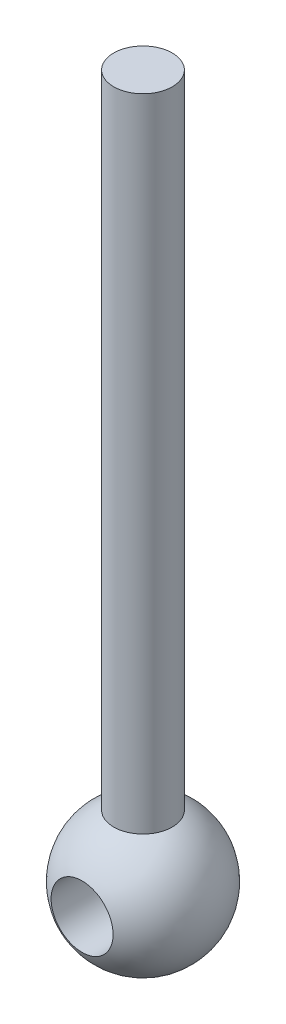
from build123d import *

# Parameters (mm, degrees)
REVOLVE1_ANGLE      = 359.999695921
BOSS_EXTRUDE1_START = 3.5
SKETCH2_R           = 3
BOSS_EXTRUDE1_DEPTH = 68.5


with BuildPart() as part:
    # Sketch1 → Revolve1 (revolve)
    with BuildSketch(Plane(origin=(0, 0, 0), x_dir=(1, 0, 0), z_dir=(0, 1, 0))):
        with BuildLine():
            Line((3.175, 6.238539493), (3.175, -6.238539493))
            ThreePointArc((3.175, -6.238539493), (7, 0), (3.175, 6.238539493))
        make_face()
    revolve(axis=Axis((0, 0, 6.238539493), (0, 0, -1)), revolution_arc=REVOLVE1_ANGLE)

    # Sketch2 → Boss-Extrude1 (add)
    with BuildSketch(Plane(origin=(0, 0, 0), x_dir=(1, 0, 0), z_dir=(0, 1, 0)).offset(BOSS_EXTRUDE1_START)):
        with Locations(Location((0, 0, 0), (0, 0, 90))):
            Circle(SKETCH2_R)
    extrude(amount=BOSS_EXTRUDE1_DEPTH)


solid = part.part
